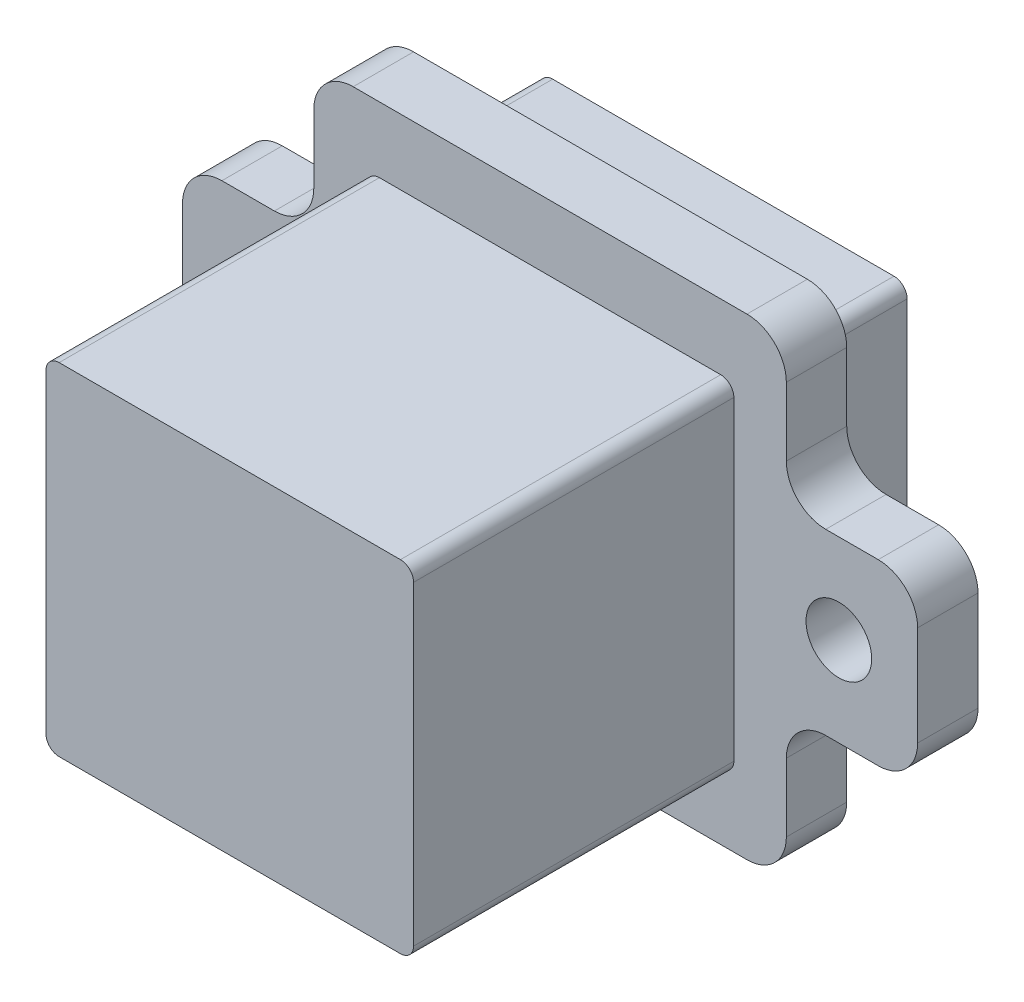
from build123d import *

# Parameters (mm, degrees)
EXTRUDE_1_DEPTH     = 2.3
SKETCH_2_W          = 14
SKETCH_2_H          = 12.9
EXTRUDE_2_DEPTH     = 4.3
CUT_EXTRUDE_1_DEPTH = 27.297528401
SKETCH_4_W          = 14
SKETCH_4_H          = 13
EXTRUDE_3_DEPTH     = 12.2
FILLET_1_R          = 0.5
SKETCH_5_W          = 6
SKETCH_5_H          = 3
EXTRUDE_4_DEPTH     = 6.2
SKETCH_6_W          = 5
SKETCH_6_H          = 6.8
EXTRUDE_5_DEPTH     = 2.3
SKETCH_7_R          = 1.25
CUT_EXTRUDE_2_DEPTH = 33.607514471
FILLET_2_R          = 1.5
FILLET_3_R          = 0.3


with BuildPart() as part:
    # Эскиз1 → Бобышка-Вытянуть1 (new body)
    with BuildSketch(Plane.XY):
        with BuildLine():
            Line((1.5, 0), (16.5, 0))
            ThreePointArc((16.5, 0), (17.560660172, 0.439339828), (18, 1.5))
            Line((18, 1.5), (18, 16.5))
            ThreePointArc((18, 16.5), (17.560660172, 17.560660172), (16.5, 18))
            Line((16.5, 18), (1.5, 18))
            ThreePointArc((1.5, 18), (0.439339828, 17.560660172), (0, 16.5))
            Line((0, 16.5), (0, 1.5))
            ThreePointArc((0, 1.5), (0.439339828, 0.439339828), (1.5, 0))
        make_face()
    extrude(amount=EXTRUDE_1_DEPTH)

    # Эскиз2 → Бобышка-Вытянуть2 (add)
    with BuildSketch(Plane(origin=(0, 0, 0), x_dir=(-1, 0, 0), z_dir=(0, 0, -1))):
        with Locations((-9, 9)):
            Rectangle(SKETCH_2_W, SKETCH_2_H)
    extrude(amount=EXTRUDE_2_DEPTH)

    # Эскиз3 → Вырез-Вытянуть1 (cut, through all)
    with BuildSketch(Plane(origin=(0, 0, -4.3), x_dir=(-1, 0, 0), z_dir=(0, 0, -1))):
        Polygon((-14.5, 12.55), (-12.83154497, 13.95), (-5.16845503, 13.95), (-3.5, 12.55), (-3.5, 4.05), (-14.5, 4.05), align=None)
    extrude(amount=-CUT_EXTRUDE_1_DEPTH, mode=Mode.SUBTRACT)

    # Эскиз4 → Бобышка-Вытянуть3 (add)
    with BuildSketch(Plane.XY.offset(2.3)):
        with Locations((9, 9)):
            Rectangle(SKETCH_4_W, SKETCH_4_H)
    extrude(amount=EXTRUDE_3_DEPTH)

    # Скругление1
    fillet_1_edges = [part.edges().sort_by_distance(p)[0] for p in [
        (16, 15.45, -2.15),
        (16, 2.55, -2.15),
        (2, 2.55, -2.15),
        (2, 15.45, -2.15),
        (2, 15.5, 8.4),
        (2, 2.5, 8.4),
        (16, 2.5, 8.4),
        (16, 15.5, 8.4),
    ]]
    fillet(fillet_1_edges, radius=FILLET_1_R)

    # Эскиз5 → Бобышка-Вытянуть4 (add)
    with BuildSketch(Plane(origin=(0, 0, 2.3), x_dir=(-1, 0, 0), z_dir=(0, 0, -1))):
        with Locations((-9, 9)):
            Rectangle(SKETCH_5_W, SKETCH_5_H)
    extrude(amount=EXTRUDE_4_DEPTH)

    # Эскиз6 → Бобышка-Вытянуть5 (add)
    with BuildSketch(Plane(origin=(0, 0, 0), x_dir=(-1, 0, 0), z_dir=(0, 0, -1))):
        with Locations((-20.5, 9)):
            Rectangle(SKETCH_6_W, SKETCH_6_H)
        with Locations((2.5, 9)):
            Rectangle(SKETCH_6_W, SKETCH_6_H)
    extrude(amount=-EXTRUDE_5_DEPTH)

    # Эскиз7 → Вырез-Вытянуть2 (cut, through all)
    with BuildSketch(Plane(origin=(0, 0, 0), x_dir=(-1, 0, 0), z_dir=(0, 0, -1))):
        with Locations((-20, 9)):
            Circle(SKETCH_7_R)
        with Locations((2, 9)):
            Circle(SKETCH_7_R)
    extrude(amount=-CUT_EXTRUDE_2_DEPTH, mode=Mode.SUBTRACT)

    # Скругление2
    fillet_2_edges = [part.edges().sort_by_distance(p)[0] for p in [
        (18, 12.4, 1.15),
        (18, 5.6, 1.15),
        (23, 5.6, 1.15),
        (23, 12.4, 1.15),
        (0, 5.6, 1.15),
        (0, 12.4, 1.15),
        (-5, 12.4, 1.15),
        (-5, 5.6, 1.15),
    ]]
    fillet(fillet_2_edges, radius=FILLET_2_R)

    # Скругление3
    fillet_3_edges = [part.edges().sort_by_distance(p)[0] for p in [
        (12, 10.5, -0.8),
        (12, 7.5, -0.8),
        (6, 7.5, -0.8),
        (6, 10.5, -0.8),
    ]]
    fillet(fillet_3_edges, radius=FILLET_3_R)


solid = part.part
